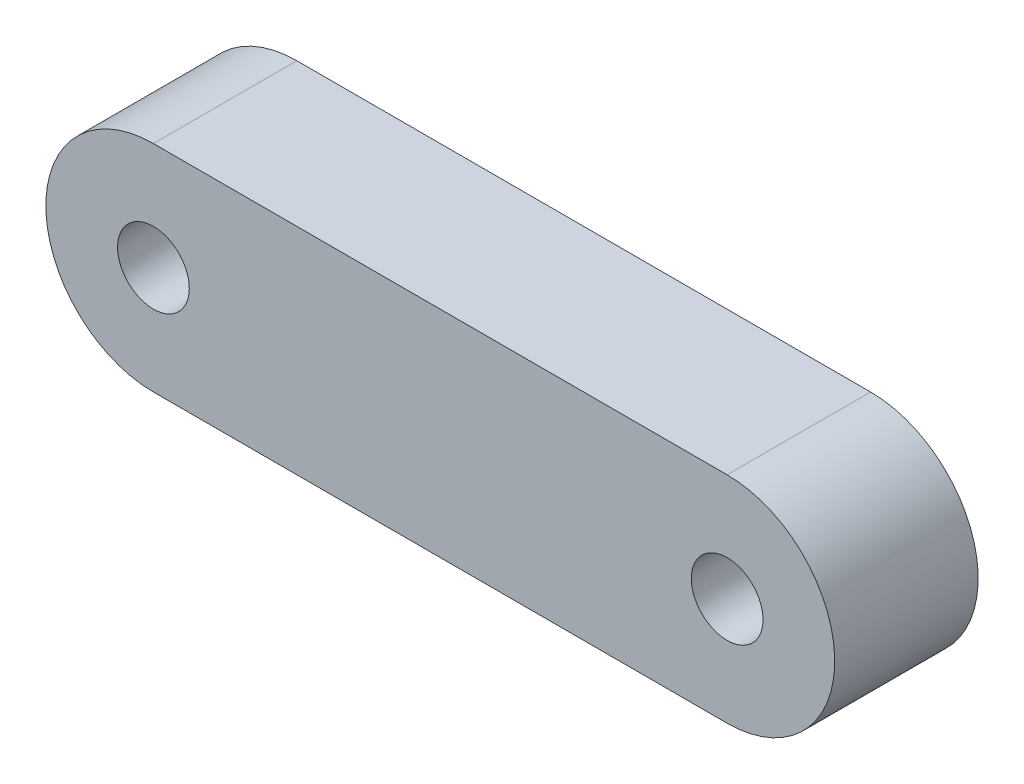
from build123d import *

# Parameters (mm, degrees)
SKETCH1_R           = 5
BOSS_EXTRUDE1_DEPTH = 20


with BuildPart() as part:
    # Sketch1 → Boss-Extrude1 (new body)
    with BuildSketch(Plane.XY):
        with BuildLine():
            Line((0, 15), (80, 15))
            ThreePointArc((80, 15), (95, 0), (80, -15))
            Line((80, -15), (0, -15))
            ThreePointArc((0, -15), (-15, 0), (0, 15))
        make_face()
        with Locations((80, 0)):
            Circle(SKETCH1_R, mode=Mode.SUBTRACT)
        Circle(SKETCH1_R, mode=Mode.SUBTRACT)
    extrude(amount=BOSS_EXTRUDE1_DEPTH)


solid = part.part
